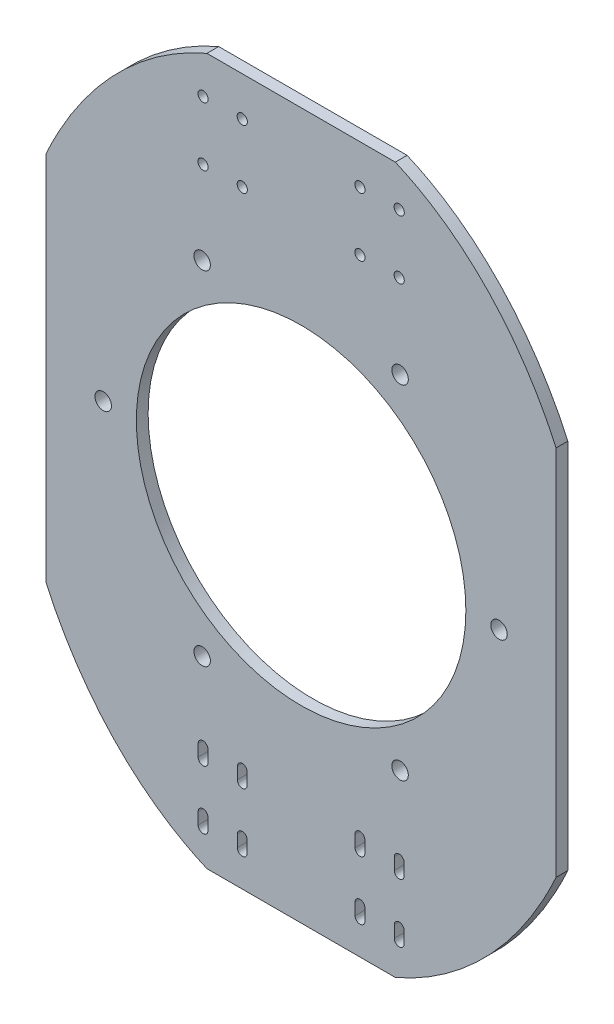
from build123d import *

# Parameters (mm, degrees)
SKETCH_1_W          = 130
SKETCH_1_H          = 180
EXTRUDE_1_DEPTH     = 3
SKETCH_5_R          = 42
CUT_EXTRUDE_2_DEPTH = 10
SKETCH_8_R          = 2.1
CUT_EXTRUDE_5_DEPTH = 10
SKETCH_9_OUTSIDE_W  = 176.412
SKETCH_9_OUTSIDE_H  = 226.412
SKETCH_9_OUTSIDE_RX = 95
SKETCH_9_OUTSIDE_RY = 75
CUT_EXTRUDE_7_DEPTH = 10
CUT_EXTRUDE_8_REACH = 113.059
SKETCH_4_R          = 1.3


with BuildPart() as part:
    # 草图1 → 凸台-拉伸1 (new body)
    with BuildSketch(Plane.XY):
        Rectangle(SKETCH_1_W, SKETCH_1_H)
    extrude(amount=EXTRUDE_1_DEPTH)

    # 草图5 → 切除-拉伸2 (cut)
    with BuildSketch(Plane.XY.offset(3)):
        Circle(SKETCH_5_R)
    extrude(amount=-CUT_EXTRUDE_2_DEPTH, mode=Mode.SUBTRACT)

    # 草图8 → 切除-拉伸5 (cut)
    with BuildSketch(Plane.XY.offset(3)):
        with Locations((-50.45, 0)):
            Circle(SKETCH_8_R)
        with Locations((-25.225, 43.690981621)):
            Circle(SKETCH_8_R)
        with Locations((25.225, 43.690981621)):
            Circle(SKETCH_8_R)
        with Locations((50.45, 0)):
            Circle(SKETCH_8_R)
        with Locations((25.225, -43.690981621)):
            Circle(SKETCH_8_R)
        with Locations((-25.225, -43.690981621)):
            Circle(SKETCH_8_R)
    extrude(amount=-CUT_EXTRUDE_5_DEPTH, mode=Mode.SUBTRACT)

    # 草图9 outside → 切除-拉伸7 (cut)
    with BuildSketch(Plane.XY.offset(3)):
        Rectangle(SKETCH_9_OUTSIDE_W, SKETCH_9_OUTSIDE_H)
        with Locations(Location((0, 0), (0, 0, -90))):
            Ellipse(SKETCH_9_OUTSIDE_RX, SKETCH_9_OUTSIDE_RY, mode=Mode.SUBTRACT)
    extrude(amount=-CUT_EXTRUDE_7_DEPTH, mode=Mode.SUBTRACT)

    # 草图4 → 切除-拉伸8 (cut, up to next)
    with BuildSketch(Plane.XY.offset(3), mode=Mode.PRIVATE) as cut_extrude_8_sk1:
        with Locations((15, 65)):
            Circle(SKETCH_4_R)
    cut_extrude_8_tool1 = extrude(cut_extrude_8_sk1.sketch, amount=-CUT_EXTRUDE_8_REACH, mode=Mode.PRIVATE) & part.part
    # 草图4 → 切除-拉伸8 (cut, up to next)
    with BuildSketch(Plane.XY.offset(3), mode=Mode.PRIVATE) as cut_extrude_8_sk2:
        with Locations((25, 65)):
            Circle(SKETCH_4_R)
    cut_extrude_8_tool2 = extrude(cut_extrude_8_sk2.sketch, amount=-CUT_EXTRUDE_8_REACH, mode=Mode.PRIVATE) & part.part
    # 草图4 → 切除-拉伸8 (cut, up to next)
    with BuildSketch(Plane.XY.offset(3), mode=Mode.PRIVATE) as cut_extrude_8_sk3:
        with Locations((25, 80)):
            Circle(SKETCH_4_R)
    cut_extrude_8_tool3 = extrude(cut_extrude_8_sk3.sketch, amount=-CUT_EXTRUDE_8_REACH, mode=Mode.PRIVATE) & part.part
    # 草图4 → 切除-拉伸8 (cut, up to next)
    with BuildSketch(Plane.XY.offset(3), mode=Mode.PRIVATE) as cut_extrude_8_sk4:
        with Locations((15, 80)):
            Circle(SKETCH_4_R)
    cut_extrude_8_tool4 = extrude(cut_extrude_8_sk4.sketch, amount=-CUT_EXTRUDE_8_REACH, mode=Mode.PRIVATE) & part.part
    # 草图4 → 切除-拉伸8 (cut, up to next)
    with BuildSketch(Plane.XY.offset(3), mode=Mode.PRIVATE) as cut_extrude_8_sk5:
        with Locations((-25, 80)):
            Circle(SKETCH_4_R)
    cut_extrude_8_tool5 = extrude(cut_extrude_8_sk5.sketch, amount=-CUT_EXTRUDE_8_REACH, mode=Mode.PRIVATE) & part.part
    # 草图4 → 切除-拉伸8 (cut, up to next)
    with BuildSketch(Plane.XY.offset(3), mode=Mode.PRIVATE) as cut_extrude_8_sk6:
        with Locations((-15, 80)):
            Circle(SKETCH_4_R)
    cut_extrude_8_tool6 = extrude(cut_extrude_8_sk6.sketch, amount=-CUT_EXTRUDE_8_REACH, mode=Mode.PRIVATE) & part.part
    # 草图4 → 切除-拉伸8 (cut, up to next)
    with BuildSketch(Plane.XY.offset(3), mode=Mode.PRIVATE) as cut_extrude_8_sk7:
        with Locations((-15, 65)):
            Circle(SKETCH_4_R)
    cut_extrude_8_tool7 = extrude(cut_extrude_8_sk7.sketch, amount=-CUT_EXTRUDE_8_REACH, mode=Mode.PRIVATE) & part.part
    # 草图4 → 切除-拉伸8 (cut, up to next)
    with BuildSketch(Plane.XY.offset(3), mode=Mode.PRIVATE) as cut_extrude_8_sk8:
        with Locations((-25, 65)):
            Circle(SKETCH_4_R)
    cut_extrude_8_tool8 = extrude(cut_extrude_8_sk8.sketch, amount=-CUT_EXTRUDE_8_REACH, mode=Mode.PRIVATE) & part.part
    # 草图4 → 切除-拉伸8 (cut, up to next)
    with BuildSketch(Plane.XY.offset(3), mode=Mode.PRIVATE) as cut_extrude_8_sk9:
        with BuildLine():
            Line((-23.75, -63.5), (-23.75, -66.5))
            ThreePointArc((-23.75, -66.5), (-25, -67.75), (-26.25, -66.5))
            Line((-26.25, -66.5), (-26.25, -63.5))
            ThreePointArc((-26.25, -63.5), (-25, -62.25), (-23.75, -63.5))
        make_face()
    cut_extrude_8_tool9 = extrude(cut_extrude_8_sk9.sketch, amount=-CUT_EXTRUDE_8_REACH, mode=Mode.PRIVATE) & part.part
    # 草图4 → 切除-拉伸8 (cut, up to next)
    with BuildSketch(Plane.XY.offset(3), mode=Mode.PRIVATE) as cut_extrude_8_sk10:
        with BuildLine():
            Line((-13.75, -63.5), (-13.75, -66.5))
            ThreePointArc((-13.75, -66.5), (-15, -67.75), (-16.25, -66.5))
            Line((-16.25, -66.5), (-16.25, -63.5))
            ThreePointArc((-16.25, -63.5), (-15, -62.25), (-13.75, -63.5))
        make_face()
    cut_extrude_8_tool10 = extrude(cut_extrude_8_sk10.sketch, amount=-CUT_EXTRUDE_8_REACH, mode=Mode.PRIVATE) & part.part
    # 草图4 → 切除-拉伸8 (cut, up to next)
    with BuildSketch(Plane.XY.offset(3), mode=Mode.PRIVATE) as cut_extrude_8_sk11:
        with BuildLine():
            Line((-23.75, -78.5), (-23.75, -81.5))
            ThreePointArc((-23.75, -81.5), (-25, -82.75), (-26.25, -81.5))
            Line((-26.25, -81.5), (-26.25, -78.5))
            ThreePointArc((-26.25, -78.5), (-25, -77.25), (-23.75, -78.5))
        make_face()
    cut_extrude_8_tool11 = extrude(cut_extrude_8_sk11.sketch, amount=-CUT_EXTRUDE_8_REACH, mode=Mode.PRIVATE) & part.part
    # 草图4 → 切除-拉伸8 (cut, up to next)
    with BuildSketch(Plane.XY.offset(3), mode=Mode.PRIVATE) as cut_extrude_8_sk12:
        with BuildLine():
            Line((-13.75, -78.5), (-13.75, -81.5))
            ThreePointArc((-13.75, -81.5), (-15, -82.75), (-16.25, -81.5))
            Line((-16.25, -81.5), (-16.25, -78.5))
            ThreePointArc((-16.25, -78.5), (-15, -77.25), (-13.75, -78.5))
        make_face()
    cut_extrude_8_tool12 = extrude(cut_extrude_8_sk12.sketch, amount=-CUT_EXTRUDE_8_REACH, mode=Mode.PRIVATE) & part.part
    # 草图4 → 切除-拉伸8 (cut, up to next)
    with BuildSketch(Plane.XY.offset(3), mode=Mode.PRIVATE) as cut_extrude_8_sk13:
        with BuildLine():
            Line((13.75, -78.5), (13.75, -81.5))
            ThreePointArc((13.75, -81.5), (15, -82.75), (16.25, -81.5))
            Line((16.25, -81.5), (16.25, -78.5))
            ThreePointArc((16.25, -78.5), (15, -77.25), (13.75, -78.5))
        make_face()
    cut_extrude_8_tool13 = extrude(cut_extrude_8_sk13.sketch, amount=-CUT_EXTRUDE_8_REACH, mode=Mode.PRIVATE) & part.part
    # 草图4 → 切除-拉伸8 (cut, up to next)
    with BuildSketch(Plane.XY.offset(3), mode=Mode.PRIVATE) as cut_extrude_8_sk14:
        with BuildLine():
            Line((23.75, -78.5), (23.75, -81.5))
            ThreePointArc((23.75, -81.5), (25, -82.75), (26.25, -81.5))
            Line((26.25, -81.5), (26.25, -78.5))
            ThreePointArc((26.25, -78.5), (25, -77.25), (23.75, -78.5))
        make_face()
    cut_extrude_8_tool14 = extrude(cut_extrude_8_sk14.sketch, amount=-CUT_EXTRUDE_8_REACH, mode=Mode.PRIVATE) & part.part
    # 草图4 → 切除-拉伸8 (cut, up to next)
    with BuildSketch(Plane.XY.offset(3), mode=Mode.PRIVATE) as cut_extrude_8_sk15:
        with BuildLine():
            Line((23.75, -63.5), (23.75, -66.5))
            ThreePointArc((23.75, -66.5), (25, -67.75), (26.25, -66.5))
            Line((26.25, -66.5), (26.25, -63.5))
            ThreePointArc((26.25, -63.5), (25, -62.25), (23.75, -63.5))
        make_face()
    cut_extrude_8_tool15 = extrude(cut_extrude_8_sk15.sketch, amount=-CUT_EXTRUDE_8_REACH, mode=Mode.PRIVATE) & part.part
    # 草图4 → 切除-拉伸8 (cut, up to next)
    with BuildSketch(Plane.XY.offset(3), mode=Mode.PRIVATE) as cut_extrude_8_sk16:
        with BuildLine():
            Line((13.75, -63.5), (13.75, -66.5))
            ThreePointArc((13.75, -66.5), (15, -67.75), (16.25, -66.5))
            Line((16.25, -66.5), (16.25, -63.5))
            ThreePointArc((16.25, -63.5), (15, -62.25), (13.75, -63.5))
        make_face()
    cut_extrude_8_tool16 = extrude(cut_extrude_8_sk16.sketch, amount=-CUT_EXTRUDE_8_REACH, mode=Mode.PRIVATE) & part.part
    add(cut_extrude_8_tool1.solids().sort_by_distance((15, 65, 3))[0], mode=Mode.SUBTRACT)
    add(cut_extrude_8_tool2.solids().sort_by_distance((25, 65, 3))[0], mode=Mode.SUBTRACT)
    add(cut_extrude_8_tool3.solids().sort_by_distance((25, 80, 3))[0], mode=Mode.SUBTRACT)
    add(cut_extrude_8_tool4.solids().sort_by_distance((15, 80, 3))[0], mode=Mode.SUBTRACT)
    add(cut_extrude_8_tool5.solids().sort_by_distance((-25, 80, 3))[0], mode=Mode.SUBTRACT)
    add(cut_extrude_8_tool6.solids().sort_by_distance((-15, 80, 3))[0], mode=Mode.SUBTRACT)
    add(cut_extrude_8_tool7.solids().sort_by_distance((-15, 65, 3))[0], mode=Mode.SUBTRACT)
    add(cut_extrude_8_tool8.solids().sort_by_distance((-25, 65, 3))[0], mode=Mode.SUBTRACT)
    add(cut_extrude_8_tool9.solids().sort_by_distance((-25, -65, 3))[0], mode=Mode.SUBTRACT)
    add(cut_extrude_8_tool10.solids().sort_by_distance((-15, -65, 3))[0], mode=Mode.SUBTRACT)
    add(cut_extrude_8_tool11.solids().sort_by_distance((-25, -80, 3))[0], mode=Mode.SUBTRACT)
    add(cut_extrude_8_tool12.solids().sort_by_distance((-15, -80, 3))[0], mode=Mode.SUBTRACT)
    add(cut_extrude_8_tool13.solids().sort_by_distance((15, -80, 3))[0], mode=Mode.SUBTRACT)
    add(cut_extrude_8_tool14.solids().sort_by_distance((25, -80, 3))[0], mode=Mode.SUBTRACT)
    add(cut_extrude_8_tool15.solids().sort_by_distance((25, -65, 3))[0], mode=Mode.SUBTRACT)
    add(cut_extrude_8_tool16.solids().sort_by_distance((15, -65, 3))[0], mode=Mode.SUBTRACT)


solid = part.part
